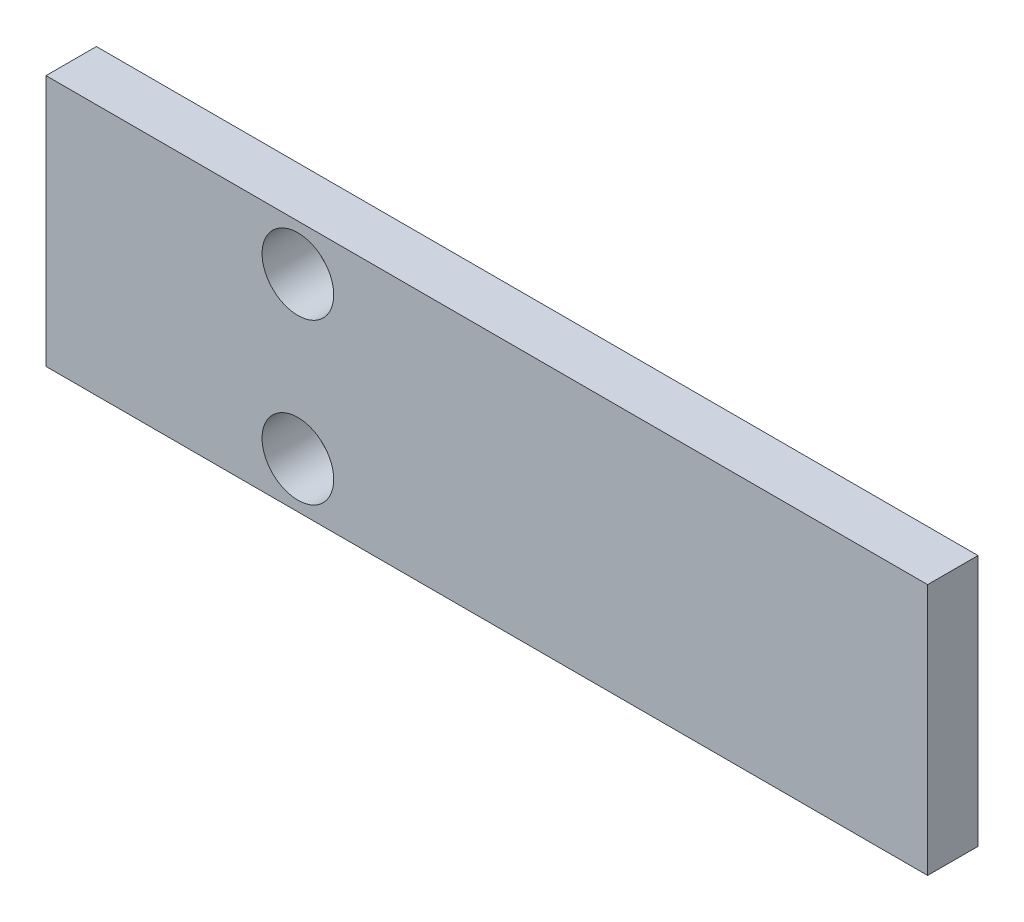
from build123d import *

# Parameters (mm, degrees)
SKETCH1_W           = 35
SKETCH1_H           = 10
BOSS_EXTRUDE1_DEPTH = 2
CUT_EXTRUDE1_REACH  = 20.31
SKETCH2_R           = 1.4224


with BuildPart() as part:
    # Sketch1 → Boss-Extrude1 (new body)
    with BuildSketch(Plane.XY):
        Rectangle(SKETCH1_W, SKETCH1_H)
    extrude(amount=BOSS_EXTRUDE1_DEPTH)

    # Sketch2 → Cut-Extrude1 (cut, up to next)
    with BuildSketch(Plane.XY.offset(2), mode=Mode.PRIVATE) as cut_extrude1_sk1:
        with Locations((-7.5, 3.175)):
            Circle(SKETCH2_R)
    cut_extrude1_tool1 = extrude(cut_extrude1_sk1.sketch, amount=-CUT_EXTRUDE1_REACH, mode=Mode.PRIVATE) & part.part
    # Sketch2 → Cut-Extrude1 (cut, up to next)
    with BuildSketch(Plane.XY.offset(2), mode=Mode.PRIVATE) as cut_extrude1_sk2:
        with Locations((-7.5, -3.175)):
            Circle(SKETCH2_R)
    cut_extrude1_tool2 = extrude(cut_extrude1_sk2.sketch, amount=-CUT_EXTRUDE1_REACH, mode=Mode.PRIVATE) & part.part
    add(cut_extrude1_tool1.solids().sort_by_distance((-7.5, 3.175, 2))[0], mode=Mode.SUBTRACT)
    add(cut_extrude1_tool2.solids().sort_by_distance((-7.5, -3.175, 2))[0], mode=Mode.SUBTRACT)


solid = part.part
